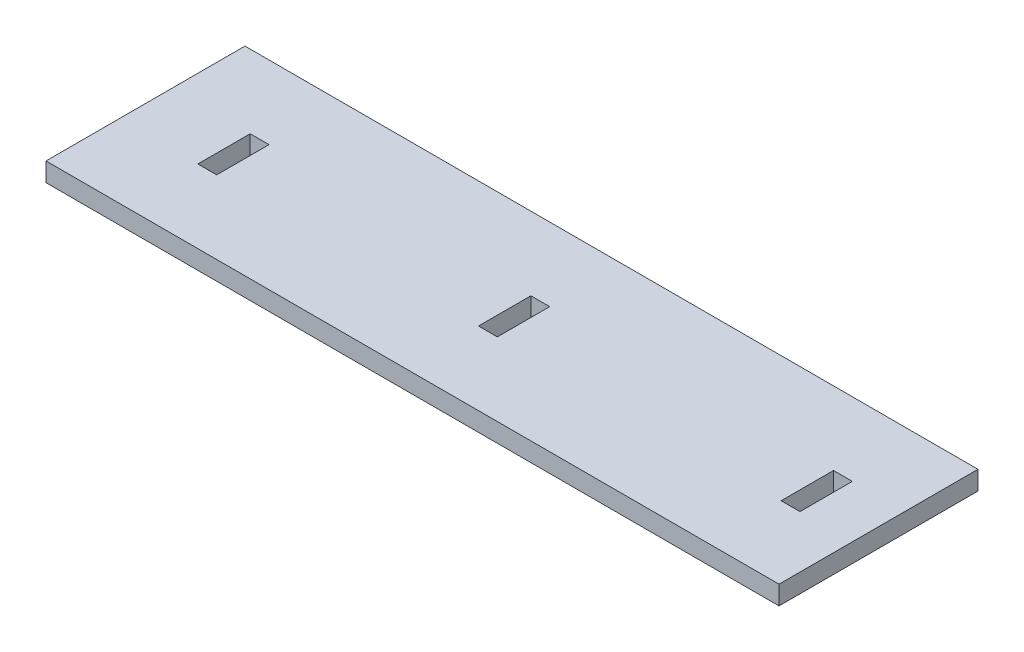
from build123d import *

# Parameters (mm, degrees)
SKETCH1_W           = 177.8
SKETCH1_H           = 48.26
SKETCH1_W_2         = 4.572
SKETCH1_H_2         = 12.7
BOSS_EXTRUDE1_DEPTH = 4.572


with BuildPart() as part:
    # Sketch1 → Boss-Extrude1 (new body)
    with BuildSketch(Plane(origin=(0, 0, 0), x_dir=(1, 0, 0), z_dir=(0, 1, 0))):
        with Locations((88.9, 24.13)):
            Rectangle(SKETCH1_W, SKETCH1_H)
        with Locations((162.814, 24.13)):
            Rectangle(SKETCH1_W_2, SKETCH1_H_2, mode=Mode.SUBTRACT)
        with Locations((89.408, 24.13)):
            Rectangle(SKETCH1_W_2, SKETCH1_H_2, mode=Mode.SUBTRACT)
        with Locations((21.336, 24.13)):
            Rectangle(SKETCH1_W_2, SKETCH1_H_2, mode=Mode.SUBTRACT)
    extrude(amount=BOSS_EXTRUDE1_DEPTH)


solid = part.part
